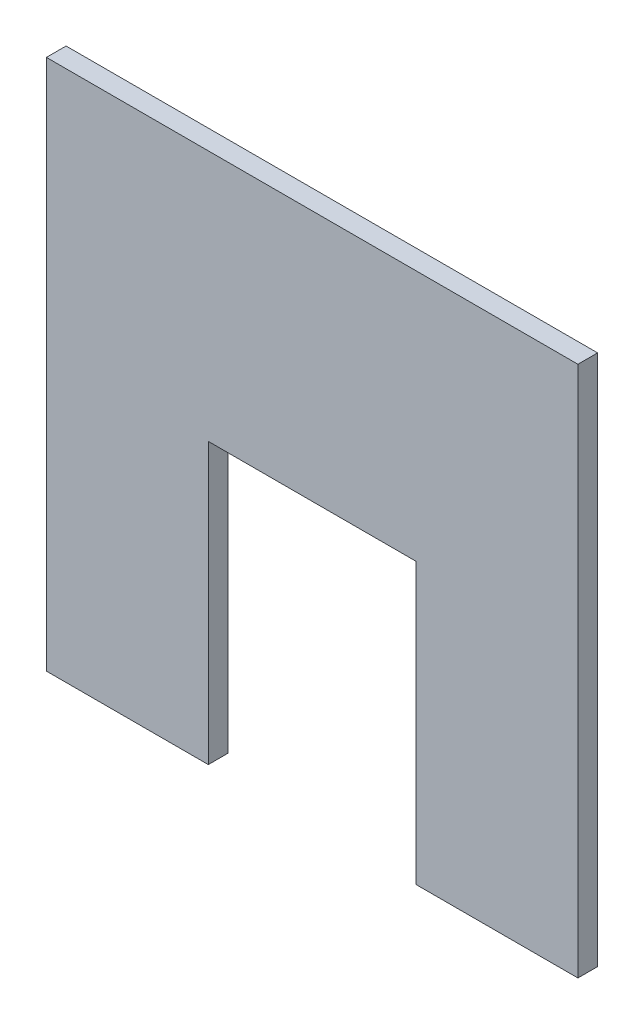
from build123d import *

# Parameters (mm, degrees)
SKETCH1_W           = 68.58
SKETCH1_H           = 68.58
BOSS_EXTRUDE2_DEPTH = 2.54
SKETCH3_W           = 26.797307975
SKETCH3_H           = 72.23417836
CUT_EXTRUDE2_DEPTH  = 36.576


with BuildPart() as part:
    # Sketch1 → Boss-Extrude2 (new body)
    with BuildSketch(Plane.XY):
        with Locations((-9.947704695, -14.183229612)):
            Rectangle(SKETCH1_W, SKETCH1_H)
    extrude(amount=BOSS_EXTRUDE2_DEPTH)

    # Sketch3 → Cut-Extrude2 (cut)
    with BuildSketch(Plane.XY.offset(2.54)):
        with Locations((-9.947704695, -48.473229612)):
            Rectangle(SKETCH3_W, SKETCH3_H)
    extrude(amount=-CUT_EXTRUDE2_DEPTH, mode=Mode.SUBTRACT)


solid = part.part
